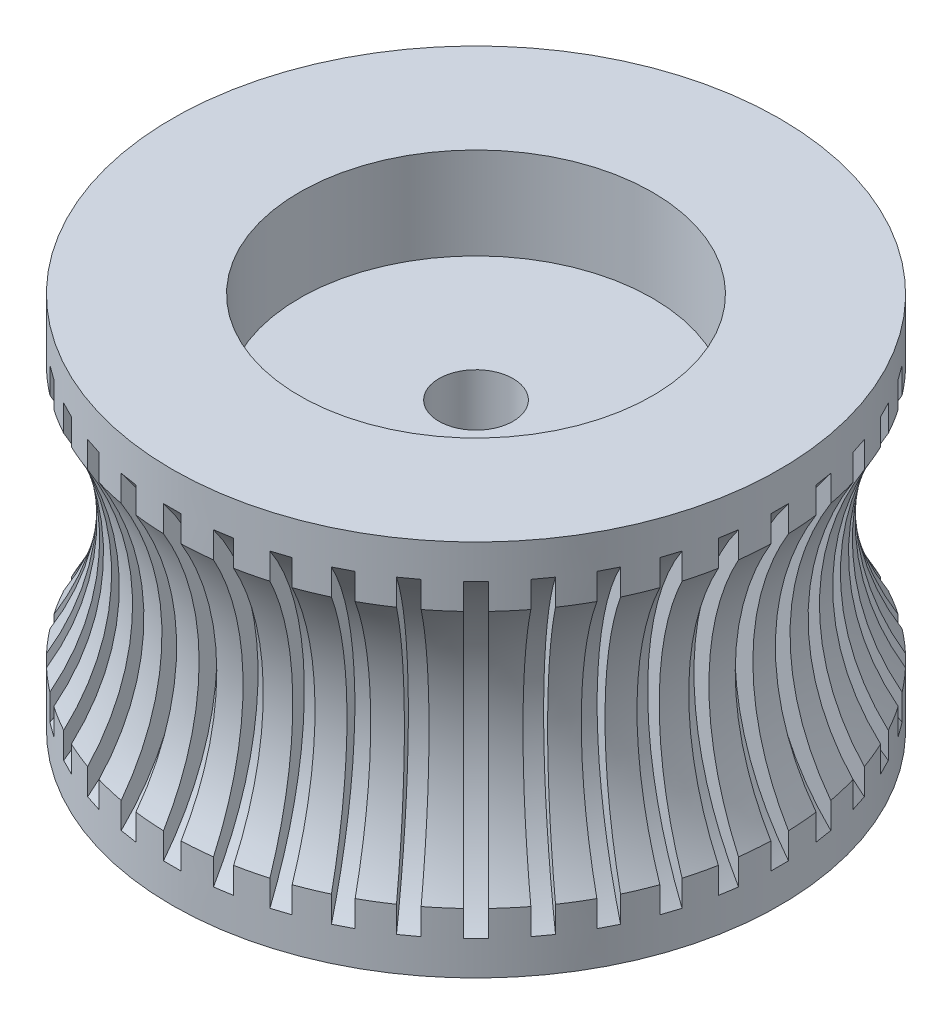
from build123d import *

# Parameters (mm, degrees)
SKETCH2_R          = 18
CUT_EXTRUDE1_DEPTH = 0.635
CIRPATTERN1_COUNT  = 40


with BuildPart() as part:
    # Sketch1 → Revolve1 (revolve)
    with BuildSketch(Plane.XY, mode=Mode.PRIVATE) as revolve1_sk:
        with BuildLine():
            Line((2.667, -3.937), (2.667, 6.985))
            Line((2.667, 6.985), (12.7, 6.985))
            Line((12.7, 6.985), (12.7, 13.589))
            Line((12.7, 13.589), (21.867553482, 13.589))
            Line((21.867553482, 13.589), (21.867553482, 9.2583))
            ThreePointArc((21.867553482, 9.2583), (19.304, 0), (21.867553482, -9.2583))
            Line((21.867553482, -9.2583), (21.867553482, -13.589))
            Line((21.867553482, -13.589), (6.096, -13.589))
            Line((6.096, -13.589), (6.096, -3.937))
            Line((6.096, -3.937), (2.667, -3.937))
        make_face()
    revolve(revolve1_sk.sketch.rotate(Axis((0, -14.9479, 0), (0, 1, 0)), 90), axis=Axis((0, -14.9479, 0), (0, 1, 0)))

    # Sketch2 → Cut-Extrude1 (cut, symmetric)
    with BuildSketch(Plane(origin=(0, 0, 0), x_dir=(0, 0, -1), z_dir=(1, 0, 0))):
        with Locations((-36, 0)):
            Circle(SKETCH2_R)
    cut_extrude1 = extrude(amount=CUT_EXTRUDE1_DEPTH, both=True, mode=Mode.SUBTRACT)

    # CirPattern1: Cut-Extrude1 ×40 about axis
    cirpattern1_axis = Axis((0, 0, 0), (0, 1, 0))
    for i in range(1, CIRPATTERN1_COUNT):
        add(cut_extrude1.rotate(cirpattern1_axis, i * 360 / CIRPATTERN1_COUNT), mode=Mode.SUBTRACT)


solid = part.part
